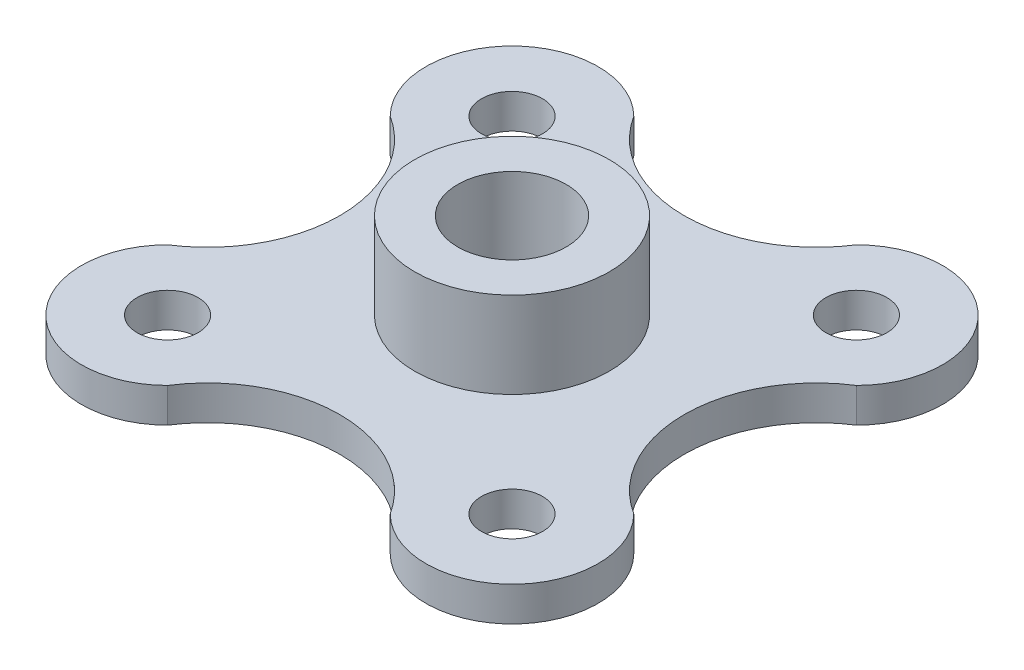
from build123d import *

# Parameters (mm, degrees)
SKETCH1_R             = 7.175
SKETCH1_R_2           = 4
BOSS_EXTRUDE1_DEPTH   = 2.54
BOSS_EXTRUDE2_START   = 2.54
SKETCH1_3_R           = 7.175
SKETCH1_3_R_2         = 4
BOSS_EXTRUDE2_DEPTH   = 6.35
F_8_CLEARANCE_HOLE1_D = 4.4958


with BuildPart() as part:
    # Sketch1 → Boss-Extrude1 (new body)
    # profile 1 of 7: a face of its own
    with BuildSketch(Plane(origin=(0, 0, 0), x_dir=(1, 0, 0), z_dir=(0, 1, 0))):
        with BuildLine():
            ThreePointArc((-6.35, -12.7), (-9.526522643, -7.199859868), (-15.878044557, -7.202497586))
            ThreePointArc((-15.878044557, -7.202497586), (-16.512685104, -7.734059372), (-17.190128061, -8.209871939))
            ThreePointArc((-17.190128061, -8.209871939), (-17.190128061, -17.190128061), (-8.209871939, -17.190128061))
            ThreePointArc((-8.209871939, -17.190128061), (-7.734059372, -16.512685104), (-7.202497586, -15.878044557))
            ThreePointArc((-7.202497586, -15.878044557), (-6.566826257, -14.345199026), (-6.35, -12.7))
        make_face()
    # profile 2 of 7: a face of its own
    with BuildSketch(Plane(origin=(0, 0, 0), x_dir=(1, 0, 0), z_dir=(0, 1, 0))):
        with BuildLine():
            ThreePointArc((7.202497586, 15.878044557), (0, 12.7), (-7.202497586, 15.878044557))
            ThreePointArc((-7.202497586, 15.878044557), (-6.566826257, 14.345199026), (-6.35, 12.7))
            ThreePointArc((-6.35, 12.7), (-9.526522643, 7.199859868), (-15.878044557, 7.202497586))
            ThreePointArc((-15.878044557, 7.202497586), (-12.7, 0), (-15.878044557, -7.202497586))
            ThreePointArc((-15.878044557, -7.202497586), (-9.526522643, -7.199859868), (-6.35, -12.7))
            ThreePointArc((-6.35, -12.7), (-6.566826257, -14.345199026), (-7.202497586, -15.878044557))
            ThreePointArc((-7.202497586, -15.878044557), (0, -12.7), (7.202497586, -15.878044557))
            ThreePointArc((7.202497586, -15.878044557), (8.209871939, -8.209871939), (15.878044557, -7.202497586))
            ThreePointArc((15.878044557, -7.202497586), (12.7, 0), (15.878044557, 7.202497586))
            ThreePointArc((15.878044557, 7.202497586), (8.209871939, 8.209871939), (7.202497586, 15.878044557))
        make_face()
        Circle(SKETCH1_R, mode=Mode.SUBTRACT)
    # profile 3 of 7: a face of its own
    with BuildSketch(Plane(origin=(0, 0, 0), x_dir=(1, 0, 0), z_dir=(0, 1, 0))):
        with BuildLine():
            ThreePointArc((17.190128061, -8.209871939), (16.512685104, -7.734059372), (15.878044557, -7.202497586))
            ThreePointArc((15.878044557, -7.202497586), (8.209871939, -8.209871939), (7.202497586, -15.878044557))
            ThreePointArc((7.202497586, -15.878044557), (7.734059372, -16.512685104), (8.209871939, -17.190128061))
            ThreePointArc((8.209871939, -17.190128061), (15.130039796, -18.566635031), (19.05, -12.7))
            ThreePointArc((19.05, -12.7), (18.566635031, -10.269960204), (17.190128061, -8.209871939))
        make_face()
    # profile 4 of 7: a face of its own
    with BuildSketch(Plane(origin=(0, 0, 0), x_dir=(1, 0, 0), z_dir=(0, 1, 0))):
        with BuildLine():
            ThreePointArc((8.209871939, 17.190128061), (7.734059372, 16.512685104), (7.202497586, 15.878044557))
            ThreePointArc((7.202497586, 15.878044557), (8.209871939, 8.209871939), (15.878044557, 7.202497586))
            ThreePointArc((15.878044557, 7.202497586), (16.512685104, 7.734059372), (17.190128061, 8.209871939))
            ThreePointArc((17.190128061, 8.209871939), (18.566635031, 10.269960204), (19.05, 12.7))
            ThreePointArc((19.05, 12.7), (15.130039796, 18.566635031), (8.209871939, 17.190128061))
        make_face()
    # profile 5 of 7: a face of its own
    with BuildSketch(Plane(origin=(0, 0, 0), x_dir=(1, 0, 0), z_dir=(0, 1, 0))):
        Circle(SKETCH1_R)
        Circle(SKETCH1_R_2, mode=Mode.SUBTRACT)
    # profile 6 of 7: a face of its own
    with BuildSketch(Plane(origin=(0, 0, 0), x_dir=(1, 0, 0), z_dir=(0, 1, 0))):
        Circle(SKETCH1_R_2)
    # profile 7 of 7: a face of its own
    with BuildSketch(Plane(origin=(0, 0, 0), x_dir=(1, 0, 0), z_dir=(0, 1, 0))):
        with BuildLine():
            ThreePointArc((-7.202497586, 15.878044557), (-7.734059372, 16.512685104), (-8.209871939, 17.190128061))
            ThreePointArc((-8.209871939, 17.190128061), (-17.190128061, 17.190128061), (-17.190128061, 8.209871939))
            ThreePointArc((-17.190128061, 8.209871939), (-16.512685104, 7.734059372), (-15.878044557, 7.202497586))
            ThreePointArc((-15.878044557, 7.202497586), (-9.526522643, 7.199859868), (-6.35, 12.7))
            ThreePointArc((-6.35, 12.7), (-6.566826257, 14.345199026), (-7.202497586, 15.878044557))
        make_face()
    extrude(amount=BOSS_EXTRUDE1_DEPTH)

    # Sketch1<3> → Boss-Extrude2 (add)
    with BuildSketch(Plane(origin=(0, 0, 0), x_dir=(1, 0, 0), z_dir=(0, 1, 0)).offset(BOSS_EXTRUDE2_START)):
        with Locations(Location((0, 0, 0), (0, 0, 270))):
            Circle(SKETCH1_3_R)
        with Locations(Location((0, 0, 0), (0, 0, 270))):
            Circle(SKETCH1_3_R_2, mode=Mode.SUBTRACT)
    extrude(amount=BOSS_EXTRUDE2_DEPTH)

    # #8 Clearance Hole1 (through all)
    with Locations(Plane(origin=(0, 2.54, 0), x_dir=(1, 0, 0), z_dir=(0, 1, 0))):
        with Locations((-12.7, 12.7), (12.7, 12.7), (12.7, -12.7), (-12.7, -12.7)):
            Hole(F_8_CLEARANCE_HOLE1_D / 2)


solid = part.part
